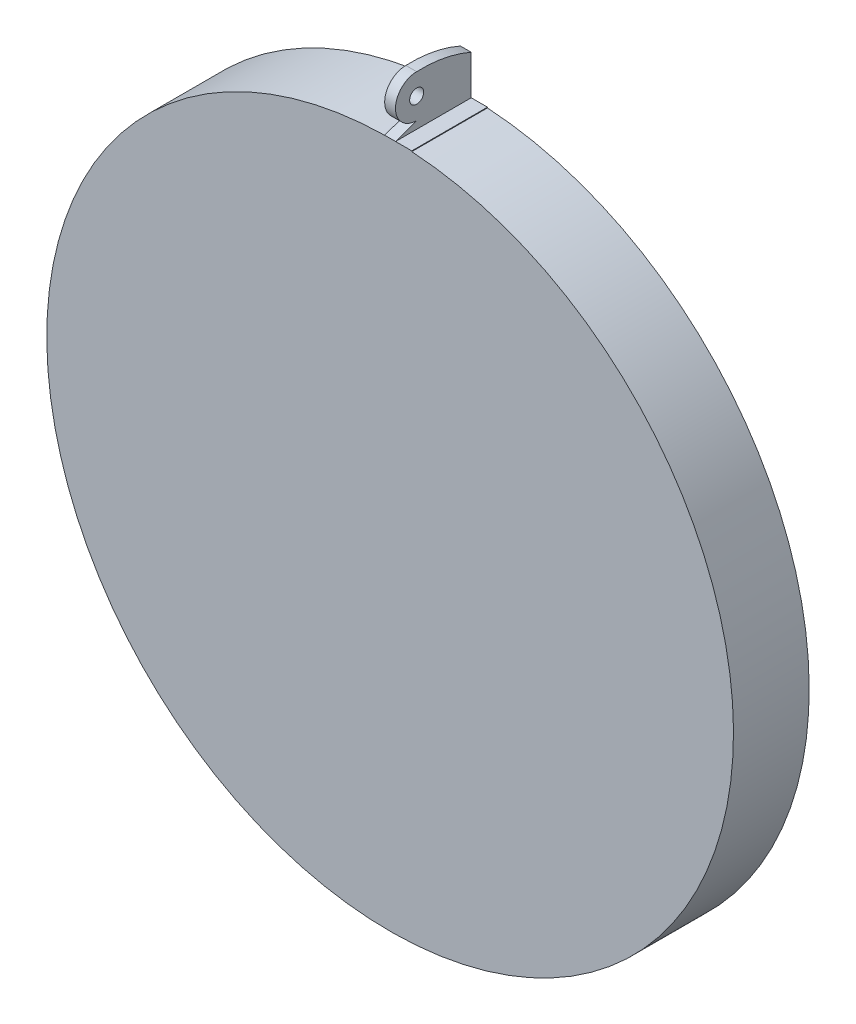
from build123d import *

# Parameters (mm, degrees)
SKETCH1_R                = 63.5
BOSS_EXTRUDE2_DEPTH      = 23
SHELL4_T                 = -3
SKETCH4_R                = 56.09702957
CUT_EXTRUDE1_DEPTH       = 22
BOSS_EXTRUDE6_DEPTH      = 1
BOSS_EXTRUDE6_DEPTH_BACK = 1
SKETCH8_R                = 1.3
BOSS_EXTRUDE7_REACH      = 145.843
BOSS_EXTRUDE7_END_RADIUS = 63.5
SKETCH9_W                = 5
SKETCH9_H                = 23
SKETCH11_R               = 63.5
CUT_EXTRUDE2_DEPTH       = 9
SKETCH12_W               = 19.480164653
SKETCH12_H               = 12.222333769
CUT_EXTRUDE3_DEPTH       = 13
BOSS_EXTRUDE8_START      = -2
SKETCH13_R               = 63.5
BOSS_EXTRUDE8_DEPTH      = 2


with BuildPart() as part:
    # Sketch1 → Boss-Extrude2 (new body)
    with BuildSketch(Plane.XY):
        Circle(SKETCH1_R)
    extrude(amount=BOSS_EXTRUDE2_DEPTH)

    # Shell4
    shell4_openings = [part.faces().sort_by_distance(p)[0] for p in [
        (0, 0, 0),
    ]]
    offset(amount=SHELL4_T, openings=shell4_openings, kind=Kind.INTERSECTION)

    # Sketch4 → Cut-Extrude1 (cut)
    with BuildSketch(Plane(origin=(0, 0, 20), x_dir=(-1, 0, 0), z_dir=(0, 0, -1))):
        Circle(SKETCH4_R)
    extrude(amount=-CUT_EXTRUDE1_DEPTH, mode=Mode.SUBTRACT)



with BuildPart() as body_2:
    # Sketch8 → Boss-Extrude6 (new, two sides: drawn at the far end of the back side and taken through both)
    with BuildSketch(Plane(origin=(0, 0, 0), x_dir=(0, 0, -1), z_dir=(1, 0, 0)).offset(-BOSS_EXTRUDE6_DEPTH_BACK)):
        with BuildLine():
            Line((-23, 63.5), (0, 63.5))
            ThreePointArc((0, 63.5), (-8.388517362, 70.509736152), (-19.092759253, 72.728481295))
            ThreePointArc((-19.092759253, 72.728481295), (-23.009560108, 68.811680441), (-19.092759253, 64.894879586))
            ThreePointArc((-19.092759253, 64.894879586), (-21.050529465, 64.209064035), (-23, 63.5))
        make_face()
        with Locations((-19.092759253, 68.811680441)):
            Circle(SKETCH8_R, mode=Mode.SUBTRACT)
    extrude(amount=BOSS_EXTRUDE6_DEPTH + BOSS_EXTRUDE6_DEPTH_BACK)


with BuildPart() as part_1:
    add(part.part)

    add(body_2.part)  # Boss-Extrude7 merges body 2
    # Boss-Extrude7: up to this cylinder (the profile starts outside it)
    boss_extrude7_end = Plane(origin=(0, 0, 11.5), z_dir=(0, 0, -1)) * Cylinder(BOSS_EXTRUDE7_END_RADIUS, 419.686, mode=Mode.PRIVATE)
    # Sketch9 → Boss-Extrude7 (add, up to the surface)
    with BuildSketch(Plane.XZ.offset(-63.5), mode=Mode.PRIVATE) as boss_extrude7_sk1:
        with Locations((1.5, 11.5)):
            Rectangle(SKETCH9_W, SKETCH9_H)
    boss_extrude7_tool1 = extrude(boss_extrude7_sk1.sketch, amount=BOSS_EXTRUDE7_REACH, mode=Mode.PRIVATE) - boss_extrude7_end
    add(boss_extrude7_tool1.solids().sort_by_distance((1.5, 63.5, 11.5))[0])
    add(boss_extrude7_tool1.solids().sort_by_distance((1.5, 63.5, 11.5))[1])

    # Sketch11 → Cut-Extrude2 (cut)
    with BuildSketch(Plane(origin=(0, 0, 0), x_dir=(-1, 0, 0), z_dir=(0, 0, -1))):
        Circle(SKETCH11_R)
    extrude(amount=-CUT_EXTRUDE2_DEPTH, mode=Mode.SUBTRACT)

    # Sketch12 → Cut-Extrude3 (cut)
    with BuildSketch(Plane(origin=(0, 0, 9), x_dir=(-1, 0, 0), z_dir=(0, 0, -1))):
        with Locations((1.337314283, 69.052754799)):
            Rectangle(SKETCH12_W, SKETCH12_H)
    extrude(amount=CUT_EXTRUDE3_DEPTH, mode=Mode.SUBTRACT)

    # Sketch13 → Boss-Extrude8 (add)
    with BuildSketch(Plane.XY.offset(23).offset(BOSS_EXTRUDE8_START)):
        Circle(SKETCH13_R)
    extrude(amount=BOSS_EXTRUDE8_DEPTH)


solid = part_1.part
